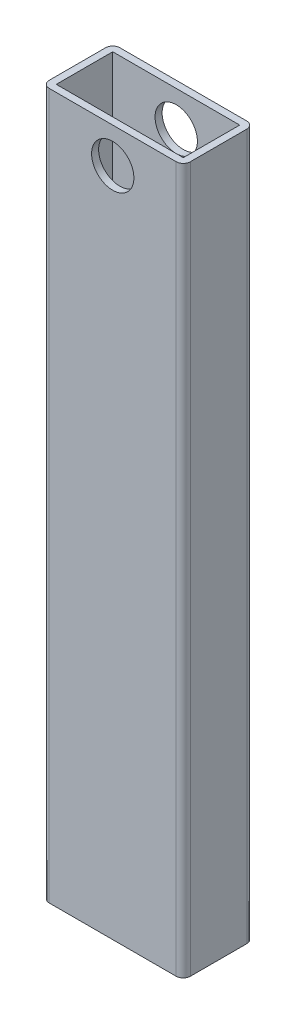
from build123d import *

# Parameters (mm, degrees)
SCHIZZO2_W                = 20
SCHIZZO2_H                = 10
SCHIZZO2_W_2              = 18
SCHIZZO2_H_2              = 8
ESTRUSIONE_SOTTILE1_DEPTH = 100
SCHIZZO3_R                = 3
TAGLIO_ESTRUSIONE1_DEPTH  = 101.995049384
RACCORDO6_R               = 1


with BuildPart() as part:
    # Schizzo2 → Estrusione-Sottile1 (new body)
    with BuildSketch(Plane(origin=(0, 0, 0), x_dir=(1, 0, 0), z_dir=(0, 1, 0))):
        Rectangle(SCHIZZO2_W, SCHIZZO2_H)
        Rectangle(SCHIZZO2_W_2, SCHIZZO2_H_2, mode=Mode.SUBTRACT)
    extrude(amount=-ESTRUSIONE_SOTTILE1_DEPTH)

    # Schizzo3 → Taglio-Estrusione1 (cut, through all)
    with BuildSketch(Plane.XY.offset(5)):
        with Locations((0, -5)):
            Circle(SCHIZZO3_R)
    extrude(amount=-TAGLIO_ESTRUSIONE1_DEPTH, mode=Mode.SUBTRACT)

    # Raccordo6
    raccordo6_edges = [part.edges().sort_by_distance(p)[0] for p in [
        (10, -50, 5),
        (-10, -50, 5),
        (-10, -50, -5),
        (10, -50, -5),
    ]]
    fillet(raccordo6_edges, radius=RACCORDO6_R)


solid = part.part
